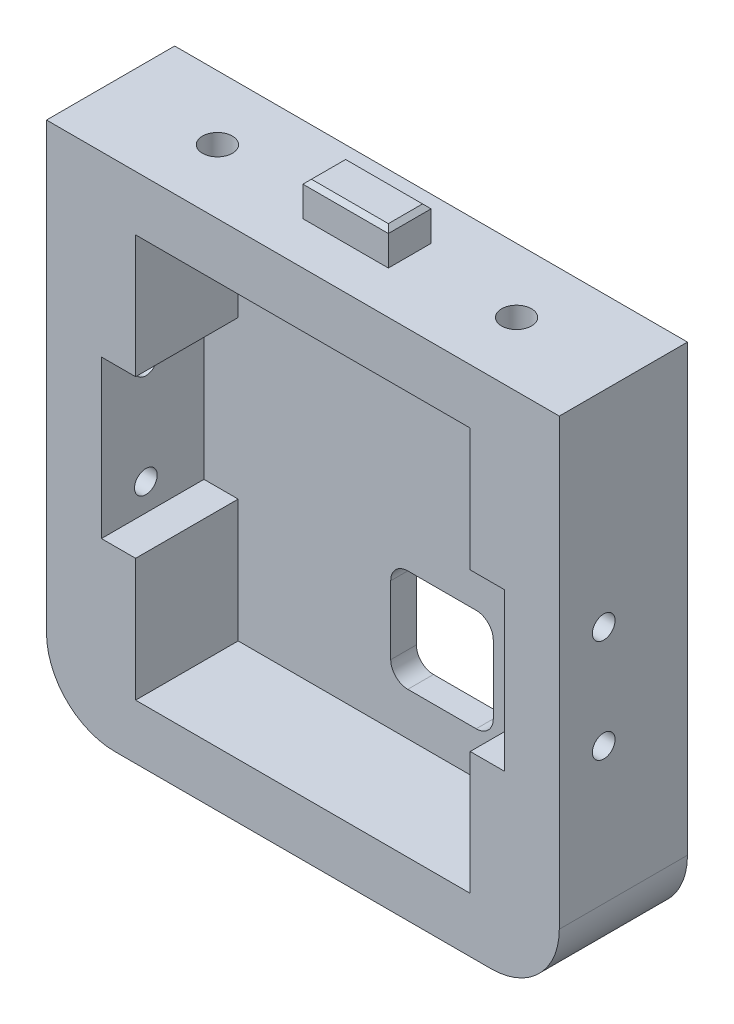
from build123d import *

# Parameters (mm, degrees)
SKETCH_3_W          = 60
SKETCH_3_H          = 60
EXTRUDE_1_DEPTH     = 15
SKETCH_4_W          = 47.15
SKETCH_4_H          = 47.15
CUT_EXTRUDE_1_DEPTH = 12
SKETCH_5_R          = 1.325
CUT_EXTRUDE_2_DEPTH = 69.738635424
EXTRUDE_2_REACH     = 47
SKETCH_6_W          = 4
SKETCH_6_H          = 14.375
FILLET_1_R          = 8
SKETCH_11_R         = 1.75
CUT_EXTRUDE_5_DEPTH = 5.5
SKETCH_12_R         = 1.4
CUT_EXTRUDE_6_DEPTH = 5.5
SKETCH_13_W         = 10
SKETCH_13_H         = 5
EXTRUDE_3_DEPTH     = 4
CHAMFER_1_SIZE      = 0.5
SKETCH_15_W         = 12
SKETCH_15_H         = 12
CUT_EXTRUDE_7_DEPTH = 47.904157598
FILLET_2_R          = 2


with BuildPart() as part:
    # 草图3 → 凸台-拉伸1 (new body)
    with BuildSketch(Plane.XY):
        Rectangle(SKETCH_3_W, SKETCH_3_H)
    extrude(amount=EXTRUDE_1_DEPTH)

    # 草图4 → 切除-拉伸1 (cut)
    with BuildSketch(Plane.XY.offset(15)):
        Rectangle(SKETCH_4_W, SKETCH_4_H)
    extrude(amount=-CUT_EXTRUDE_1_DEPTH, mode=Mode.SUBTRACT)

    # 草图5 → 切除-拉伸2 (cut, through all)
    with BuildSketch(Plane.ZY.offset(30)):
        with Locations(Location((9.8, 6.025, 0), (0, 0, 270))):
            Circle(SKETCH_5_R)
        with Locations(Location((9.8, -6.025, 0), (0, 0, 270))):
            Circle(SKETCH_5_R)
    extrude(amount=-CUT_EXTRUDE_2_DEPTH, mode=Mode.SUBTRACT)

    # 草图6 → 凸台-拉伸2 (add, up to next)
    with BuildSketch(Plane.XY.offset(15), mode=Mode.PRIVATE) as extrude_2_sk1:
        with Locations((-21.575, 16.3875)):
            Rectangle(SKETCH_6_W, SKETCH_6_H)
    extrude_2_tool1 = extrude(extrude_2_sk1.sketch, amount=-EXTRUDE_2_REACH, mode=Mode.PRIVATE) - part.part
    # 草图6 → 凸台-拉伸2 (add, up to next)
    with BuildSketch(Plane.XY.offset(15), mode=Mode.PRIVATE) as extrude_2_sk2:
        with Locations((21.575, 16.3875)):
            Rectangle(SKETCH_6_W, SKETCH_6_H)
    extrude_2_tool2 = extrude(extrude_2_sk2.sketch, amount=-EXTRUDE_2_REACH, mode=Mode.PRIVATE) - part.part
    # 草图6 → 凸台-拉伸2 (add, up to next)
    with BuildSketch(Plane.XY.offset(15), mode=Mode.PRIVATE) as extrude_2_sk3:
        with Locations((21.575, -16.3875)):
            Rectangle(SKETCH_6_W, SKETCH_6_H)
    extrude_2_tool3 = extrude(extrude_2_sk3.sketch, amount=-EXTRUDE_2_REACH, mode=Mode.PRIVATE) - part.part
    # 草图6 → 凸台-拉伸2 (add, up to next)
    with BuildSketch(Plane.XY.offset(15), mode=Mode.PRIVATE) as extrude_2_sk4:
        with Locations((-21.575, -16.3875)):
            Rectangle(SKETCH_6_W, SKETCH_6_H)
    extrude_2_tool4 = extrude(extrude_2_sk4.sketch, amount=-EXTRUDE_2_REACH, mode=Mode.PRIVATE) - part.part
    add(extrude_2_tool1.solids().sort_by_distance((-21.575, 16.3875, 15))[0])
    add(extrude_2_tool2.solids().sort_by_distance((21.575, 16.3875, 15))[0])
    add(extrude_2_tool3.solids().sort_by_distance((21.575, -16.3875, 15))[0])
    add(extrude_2_tool4.solids().sort_by_distance((-21.575, -16.3875, 15))[0])

    # 圆角1
    fillet_1_edges = [part.edges().sort_by_distance(p)[0] for p in [
        (30, -30, 7.5),
        (-30, -30, 7.5),
    ]]
    fillet(fillet_1_edges, radius=FILLET_1_R)

    # 草图11 → 切除-拉伸5 (cut)
    with BuildSketch(Plane(origin=(0, 30, 0), x_dir=(1, 0, 0), z_dir=(0, 1, 0))):
        with Locations(Location((-17.5, -7.5, 0), (0, 0, 270))):
            Circle(SKETCH_11_R)
        with Locations(Location((17.5, -7.5, 0), (0, 0, 90))):
            Circle(SKETCH_11_R)
    extrude(amount=-CUT_EXTRUDE_5_DEPTH, mode=Mode.SUBTRACT)

    # 草图12 → 切除-拉伸6 (cut)
    with BuildSketch(Plane.XZ.offset(30)):
        with Locations(Location((-17.5, 7.5, 0), (0, 0, 270))):
            Circle(SKETCH_12_R)
        with Locations(Location((17.5, 7.5, 0), (0, 0, 90))):
            Circle(SKETCH_12_R)
    extrude(amount=-CUT_EXTRUDE_6_DEPTH, mode=Mode.SUBTRACT)

    # 草图13 → 凸台-拉伸3 (add)
    with BuildSketch(Plane(origin=(0, 30, 0), x_dir=(1, 0, 0), z_dir=(0, 1, 0))):
        with Locations((0, -7.5)):
            Rectangle(SKETCH_13_W, SKETCH_13_H)
    extrude(amount=EXTRUDE_3_DEPTH)

    # 倒角1
    chamfer_1_edges = [part.edges().sort_by_distance(p)[0] for p in [
        (5, 34, 7.5),
        (0, 34, 5),
        (-5, 34, 7.5),
        (0, 34, 10),
    ]]
    chamfer(chamfer_1_edges, length=CHAMFER_1_SIZE)

    # 草图15 → 切除-拉伸7 (cut, through all)
    with BuildSketch(Plane.XY.offset(3)):
        with Locations((4.275, -12.55)):
            Rectangle(SKETCH_15_W, SKETCH_15_H)
    extrude(amount=-CUT_EXTRUDE_7_DEPTH, mode=Mode.SUBTRACT)

    # 圆角2
    fillet_2_edges = [part.edges().sort_by_distance(p)[0] for p in [
        (-1.725, -18.55, 1.5),
        (-1.725, -6.55, 1.5),
        (10.275, -6.55, 1.5),
        (10.275, -18.55, 1.5),
    ]]
    fillet(fillet_2_edges, radius=FILLET_2_R)


solid = part.part
